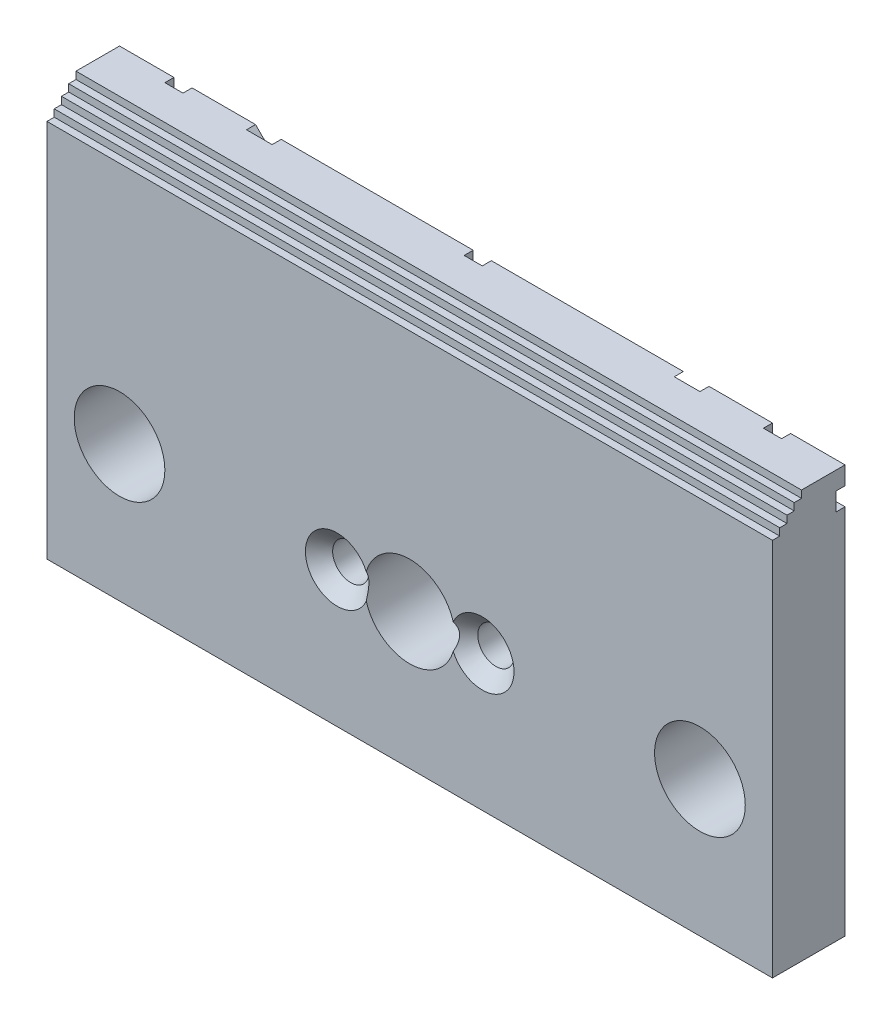
from build123d import *

# Parameters (mm, degrees)
SKETCH_1_W                     = 80
SKETCH_1_H                     = 60
EXTRUDE_1_DEPTH                = 8
HOLE_WIZARD_10_0_10_1_D        = 10
HOLE_WIZARD_10_0_10_2_D        = 10
HOLE_WIZARD_M3_5_1_D           = 4
HOLE_WIZARD_M3_5_1_CSINK_D     = 7
HOLE_WIZARD_M3_5_1_CSINK_ANGLE = 90
CUT_EXTRUDE_1_DEPTH            = 1
CUT_EXTRUDE_2_REACH            = 95.053
CUT_EXTRUDE_3_REACH            = 94.961
SKETCH_29_W                    = 80
SKETCH_29_H                    = 15


with BuildPart() as part:
    # 草图1 → 凸台-拉伸1 (new body)
    with BuildSketch(Plane(origin=(0, 0, 1), x_dir=(-1, 0, 0), z_dir=(0, 0, -1))):
        with Locations((-40, 16.666666667)):
            Rectangle(SKETCH_1_W, SKETCH_1_H)
    extrude(amount=-EXTRUDE_1_DEPTH)

    # Ø10.0 (10) 直径孔1 (through all)
    with Locations(Plane.XY.offset(9)):
        with Locations((72, 16.666666667), (8, 16.666666667)):
            Hole(HOLE_WIZARD_10_0_10_1_D / 2)

    # Ø10.0 (10) 直径孔2 (through all)
    with Locations(Plane(origin=(0, 0, 1), x_dir=(-1, 0, 0), z_dir=(0, 0, -1))):
        with Locations((-40, 16.666666667)):
            Hole(HOLE_WIZARD_10_0_10_2_D / 2)

    # M3.5 平头机械螺钉的锥形沉头孔1 (through all)
    with Locations(Plane.XY.offset(9)):
        with Locations((32, 16.666666667), (48, 16.666666667)):
            CounterSinkHole(HOLE_WIZARD_M3_5_1_D / 2, HOLE_WIZARD_M3_5_1_CSINK_D / 2, counter_sink_angle=HOLE_WIZARD_M3_5_1_CSINK_ANGLE)

    # 草图27 → 切除-拉伸1 (cut)
    with BuildSketch(Plane(origin=(0, 0, 1), x_dir=(-1, 0, 0), z_dir=(0, 0, -1))):
        with BuildLine():
            ThreePointArc((-41, 30.666666667), (-40, 29.666666667), (-39, 30.666666667))
            Line((-39, 30.666666667), (-39, 42.666666667))
            Line((-39, 42.666666667), (-21.828427125, 42.666666667))
            Line((-21.828427125, 42.666666667), (-32.414213562, 32.080880229))
            ThreePointArc((-32.414213562, 32.080880229), (-32.414213562, 30.666666667), (-31, 30.666666667))
            Line((-31, 30.666666667), (-19, 42.666666667))
            Line((-19, 42.666666667), (-8, 42.666666667))
            Line((-8, 42.666666667), (-8, 30.666666667))
            ThreePointArc((-8, 30.666666667), (-7, 29.666666667), (-6, 30.666666667))
            Line((-6, 30.666666667), (-6, 42.666666667))
            Line((-6, 42.666666667), (0, 42.666666667))
            Line((0, 42.666666667), (0, 44.666666667))
            Line((0, 44.666666667), (-6, 44.666666667))
            Line((-6, 44.666666667), (-6, 46.666666667))
            Line((-6, 46.666666667), (-8, 46.666666667))
            Line((-8, 46.666666667), (-8, 44.666666667))
            Line((-8, 44.666666667), (-17, 44.666666667))
            Line((-17, 44.666666667), (-15, 46.666666667))
            Line((-15, 46.666666667), (-16.414213562, 48.080880229))
            Line((-16.414213562, 48.080880229), (-19.828427125, 44.666666667))
            Line((-19.828427125, 44.666666667), (-39, 44.666666667))
            Line((-39, 44.666666667), (-39, 46.666666667))
            Line((-39, 46.666666667), (-41, 46.666666667))
            Line((-41, 46.666666667), (-41, 44.666666667))
            Line((-41, 44.666666667), (-60.171572875, 44.666666667))
            Line((-60.171572875, 44.666666667), (-63.585786438, 48.080880229))
            Line((-63.585786438, 48.080880229), (-65, 46.666666667))
            Line((-65, 46.666666667), (-63, 44.666666667))
            Line((-63, 44.666666667), (-72, 44.666666667))
            Line((-72, 44.666666667), (-72, 46.666666667))
            Line((-72, 46.666666667), (-74, 46.666666667))
            Line((-74, 46.666666667), (-74, 44.666666667))
            Line((-74, 44.666666667), (-80, 44.666666667))
            Line((-80, 44.666666667), (-80, 42.666666667))
            Line((-80, 42.666666667), (-74, 42.666666667))
            Line((-74, 42.666666667), (-74, 30.666666667))
            ThreePointArc((-74, 30.666666667), (-73, 29.666666667), (-72, 30.666666667))
            Line((-72, 30.666666667), (-72, 42.666666667))
            Line((-72, 42.666666667), (-61, 42.666666667))
            Line((-61, 42.666666667), (-49, 30.666666667))
            ThreePointArc((-49, 30.666666667), (-47.585786438, 30.666666667), (-47.585786438, 32.080880229))
            Line((-47.585786438, 32.080880229), (-58.171572875, 42.666666667))
            Line((-58.171572875, 42.666666667), (-41, 42.666666667))
            Line((-41, 42.666666667), (-41, 30.666666667))
        make_face()
    extrude(amount=-CUT_EXTRUDE_1_DEPTH, mode=Mode.SUBTRACT)

    # 草图28 → 切除-拉伸2 (cut, up to next)
    with BuildSketch(Plane.ZY, mode=Mode.PRIVATE) as cut_extrude_2_sk1:
        Polygon((9, 46.666666667), (5.8, 46.666666667), (5.8, 45.866666667), (6.6, 45.866666667), (6.6, 45.066666667), (7.4, 45.066666667), (7.4, 44.266666667), (8.2, 44.266666667), (8.2, 43.466666667), (9, 43.466666667), align=None)
    cut_extrude_2_tool1 = extrude(cut_extrude_2_sk1.sketch, amount=-CUT_EXTRUDE_2_REACH, mode=Mode.PRIVATE) & part.part
    add(cut_extrude_2_tool1.solids().sort_by_distance((0, 45.466667, 7.8))[0], mode=Mode.SUBTRACT)

    # 草图29 → 切除-拉伸3 (cut, up to next)
    with BuildSketch(Plane(origin=(0, 0, 1), x_dir=(-1, 0, 0), z_dir=(0, 0, -1)), mode=Mode.PRIVATE) as cut_extrude_3_sk1:
        with Locations((-40, -5.833333333)):
            Rectangle(SKETCH_29_W, SKETCH_29_H)
    cut_extrude_3_tool1 = extrude(cut_extrude_3_sk1.sketch, amount=-CUT_EXTRUDE_3_REACH, mode=Mode.PRIVATE) & part.part
    add(cut_extrude_3_tool1.solids().sort_by_distance((40, -5.833333, 1))[0], mode=Mode.SUBTRACT)


solid = part.part
